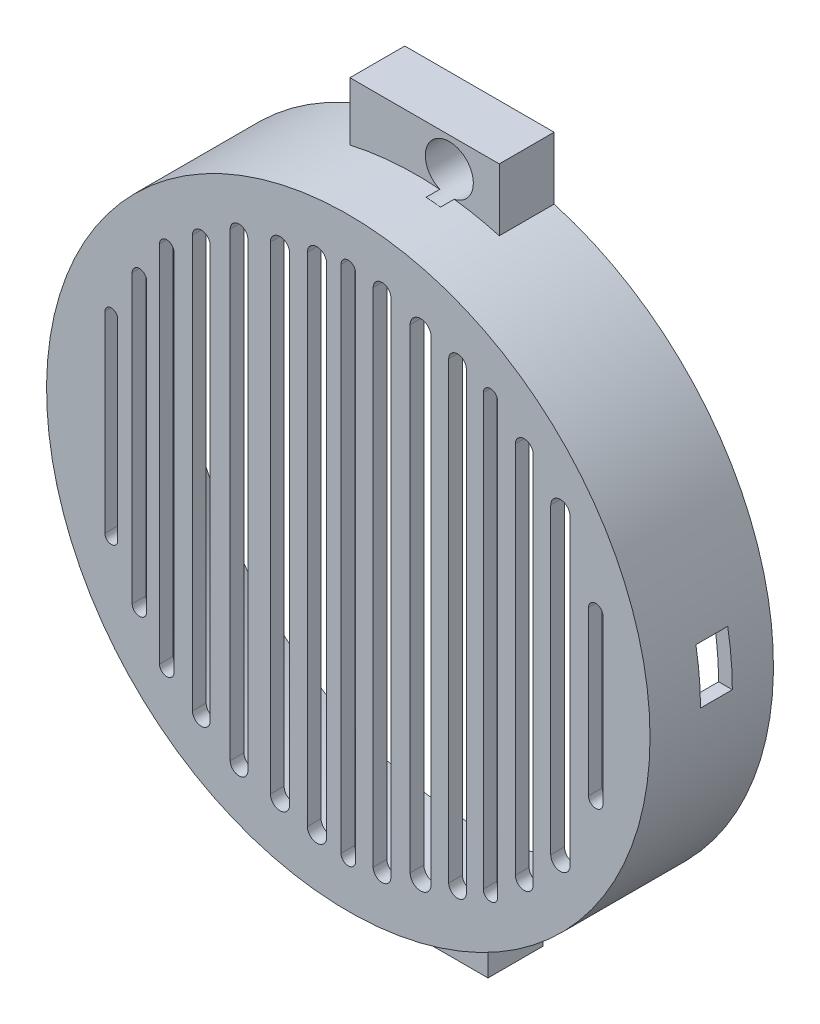
from build123d import *

# Parameters (mm, degrees)
SKETCH1_R           = 22
BOSS_EXTRUDE1_DEPTH = 9
SHELL2_T            = -1
CUT_EXTRUDE1_DEPTH  = 5
CUT_EXTRUDE2_DEPTH  = 5
SKETCH24_W          = 2.319445398
SKETCH24_H          = 3.83352781
CUT_EXTRUDE3_DEPTH  = 5
SKETCH25_W          = 10.887577437
SKETCH25_H          = 4.540244535
BOSS_EXTRUDE2_DEPTH = 4
SKETCH26_R          = 1.75
CUT_EXTRUDE4_DEPTH  = 5
SKETCH27_W          = 9.75823175
SKETCH27_H          = 4.730401218
BOSS_EXTRUDE3_DEPTH = 4
SKETCH28_R          = 1.75
CUT_EXTRUDE5_DEPTH  = 6


with BuildPart() as part:
    # Sketch1 → Boss-Extrude1 (new body)
    with BuildSketch(Plane.XY):
        Circle(SKETCH1_R)
    extrude(amount=BOSS_EXTRUDE1_DEPTH)

    # Shell2
    shell2_openings = [part.faces().sort_by_distance(p)[0] for p in [
        (0, 0, 0),
    ]]
    offset(amount=SHELL2_T, openings=shell2_openings, kind=Kind.INTERSECTION)

    # Sketch23 → Cut-Extrude1 (cut)
    with BuildSketch(Plane(origin=(0, 0, 8), x_dir=(-1, 0, 0), z_dir=(0, 0, -1))):
        with BuildLine():
            Line((-3.104308234, -18.303704212), (-3.104308234, 18.303704212))
            ThreePointArc((-3.104308234, 18.303704212), (-2.460017846, 18.9479946), (-1.815727458, 18.303704212))
            Line((-1.815727458, 18.303704212), (-1.815727458, -18.303704212))
            ThreePointArc((-1.815727458, -18.303704212), (-2.460017846, -18.9479946), (-3.104308234, -18.303704212))
        make_face()
        with BuildLine():
            Line((-6.032900908, -17.307982703), (-6.032900908, 17.307982703))
            ThreePointArc((-6.032900908, 17.307982703), (-5.271466813, 18.069416798), (-4.510032718, 17.307982703))
            Line((-4.510032718, 17.307982703), (-4.510032718, -17.307982703))
            ThreePointArc((-4.510032718, -17.307982703), (-5.271466813, -18.069416798), (-6.032900908, -17.307982703))
        make_face()
        with BuildLine():
            Line((-8.610062461, -16.546548608), (-8.610062461, 16.546548608))
            ThreePointArc((-8.610062461, 16.546548608), (-7.965772073, 17.190838996), (-7.321481685, 16.546548608))
            Line((-7.321481685, 16.546548608), (-7.321481685, -16.546548608))
            ThreePointArc((-7.321481685, -16.546548608), (-7.965772073, -17.190838996), (-8.610062461, -16.546548608))
        make_face()
        with BuildLine():
            Line((-10.894364747, -15.667970806), (-10.894364747, 15.667970806))
            ThreePointArc((-10.894364747, 15.667970806), (-10.367218066, 16.195117487), (-9.840071384, 15.667970806))
            Line((-9.840071384, 15.667970806), (-9.840071384, -15.667970806))
            ThreePointArc((-9.840071384, -15.667970806), (-10.367218066, -16.195117487), (-10.894364747, -15.667970806))
        make_face()
        with BuildLine():
            Line((-13.4715263, -13.617955934), (-13.4715263, 13.617955934))
            ThreePointArc((-13.4715263, 13.617955934), (-12.827235912, 14.262246322), (-12.182945524, 13.617955934))
            Line((-12.182945524, 13.617955934), (-12.182945524, -13.617955934))
            ThreePointArc((-12.182945524, -13.617955934), (-12.827235912, -14.262246322), (-13.4715263, -13.617955934))
        make_face()
        with BuildLine():
            Line((-16.16583156, -11.040794381), (-16.16583156, 11.040794381))
            ThreePointArc((-16.16583156, 11.040794381), (-15.462969318, 11.743656623), (-14.760107077, 11.040794381))
            Line((-14.760107077, 11.040794381), (-14.760107077, -11.040794381))
            ThreePointArc((-14.760107077, -11.040794381), (-15.462969318, -11.743656623), (-16.16583156, -11.040794381))
        make_face()
        with BuildLine():
            Line((-18.567277553, -5.945043128), (-18.567277553, 5.945043128))
            ThreePointArc((-18.567277553, 5.945043128), (-18.040130871, 6.472189809), (-17.51298419, 5.945043128))
            Line((-17.51298419, 5.945043128), (-17.51298419, -5.945043128))
            ThreePointArc((-17.51298419, -5.945043128), (-18.040130871, -6.472189809), (-18.567277553, -5.945043128))
        make_face()
    extrude(amount=-CUT_EXTRUDE1_DEPTH, mode=Mode.SUBTRACT)

    # Sketch22 → Cut-Extrude2 (cut)
    with BuildSketch(Plane(origin=(0, 0, 8), x_dir=(-1, 0, 0), z_dir=(0, 0, -1))):
        with BuildLine():
            Line((-0.527146681, -18.59656348), (-0.527146681, 18.59656348))
            ThreePointArc((-0.527146681, 18.59656348), (0, 19.123710161), (0.527146681, 18.59656348))
            Line((0.527146681, 18.59656348), (0.527146681, -18.59656348))
            ThreePointArc((0.527146681, -18.59656348), (0, -19.123710161), (-0.527146681, -18.59656348))
        make_face()
        with BuildLine():
            Line((1.581440044, -18.127988652), (1.581440044, 18.127988652))
            ThreePointArc((1.581440044, 18.127988652), (2.284302286, 18.830850893), (2.987164527, 18.127988652))
            Line((2.987164527, 18.127988652), (2.987164527, -18.127988652))
            ThreePointArc((2.987164527, -18.127988652), (2.284302286, -18.830850893), (1.581440044, -18.127988652))
        make_face()
        with BuildLine():
            Line((4.275745304, -17.42512641), (4.275745304, 17.42512641))
            ThreePointArc((4.275745304, 17.42512641), (4.978607546, 18.127988652), (5.681469787, 17.42512641))
            Line((5.681469787, 17.42512641), (5.681469787, -17.42512641))
            ThreePointArc((5.681469787, -17.42512641), (4.978607546, -18.127988652), (4.275745304, -17.42512641))
        make_face()
        with BuildLine():
            Line((7.321481685, -16.780836022), (7.321481685, 16.780836022))
            ThreePointArc((7.321481685, 16.780836022), (7.965772073, 17.42512641), (8.610062461, 16.780836022))
            Line((8.610062461, 16.780836022), (8.610062461, -16.780836022))
            ThreePointArc((8.610062461, -16.780836022), (7.965772073, -17.42512641), (7.321481685, -16.780836022))
        make_face()
        with BuildLine():
            Line((10.074358798, -15.023680417), (10.074358798, 15.023680417))
            ThreePointArc((10.074358798, 15.023680417), (10.718649187, 15.667970806), (11.362939575, 15.023680417))
            Line((11.362939575, 15.023680417), (11.362939575, -15.023680417))
            ThreePointArc((11.362939575, -15.023680417), (10.718649187, -15.667970806), (10.074358798, -15.023680417))
        make_face()
        with BuildLine():
            Line((12.710092205, -13.266524813), (12.710092205, 13.266524813))
            ThreePointArc((12.710092205, 13.266524813), (13.237238886, 13.793671494), (13.764385568, 13.266524813))
            Line((13.764385568, 13.266524813), (13.764385568, -13.266524813))
            ThreePointArc((13.764385568, -13.266524813), (13.237238886, -13.793671494), (12.710092205, -13.266524813))
        make_face()
        with BuildLine():
            Line((14.701535223, -10.455075846), (14.701535223, 10.455075846))
            ThreePointArc((14.701535223, 10.455075846), (15.228681905, 10.982222527), (15.755828586, 10.455075846))
            Line((15.755828586, 10.455075846), (15.755828586, -10.455075846))
            ThreePointArc((15.755828586, -10.455075846), (15.228681905, -10.982222527), (14.701535223, -10.455075846))
        make_face()
        with BuildLine():
            Line((16.810121948, -6.999336491), (16.810121948, 6.999336491))
            ThreePointArc((16.810121948, 6.999336491), (17.278696776, 7.467911319), (17.747271604, 6.999336491))
            Line((17.747271604, 6.999336491), (17.747271604, -6.999336491))
            ThreePointArc((17.747271604, -6.999336491), (17.278696776, -7.467911319), (16.810121948, -6.999336491))
        make_face()
    extrude(amount=-CUT_EXTRUDE2_DEPTH, mode=Mode.SUBTRACT)

    # Sketch24 → Cut-Extrude3 (cut)
    with BuildSketch(Plane(origin=(22, 0, 0), x_dir=(0, 0, -1), z_dir=(1, 0, 0))):
        with Locations((-4.159722699, 1.916763905)):
            Rectangle(SKETCH24_W, SKETCH24_H)
    extrude(amount=-CUT_EXTRUDE3_DEPTH, mode=Mode.SUBTRACT)

    # Sketch25 → Boss-Extrude2 (add)
    with BuildSketch(Plane(origin=(0, 0, 0), x_dir=(-1, 0, 0), z_dir=(0, 0, -1))):
        with Locations((-0.56321323, 23.434146639)):
            Rectangle(SKETCH25_W, SKETCH25_H)
    extrude(amount=-BOSS_EXTRUDE2_DEPTH)

    # Sketch26 → Cut-Extrude4 (cut)
    with BuildSketch(Plane(origin=(0, 0, 0), x_dir=(-1, 0, 0), z_dir=(0, 0, -1))):
        with Locations((-2.366226378, 23.54446207)):
            Circle(SKETCH26_R)
    extrude(amount=-CUT_EXTRUDE4_DEPTH, mode=Mode.SUBTRACT)

    # Sketch27 → Boss-Extrude3 (add)
    with BuildSketch(Plane(origin=(0, 0, 0), x_dir=(-1, 0, 0), z_dir=(0, 0, -1))):
        with Locations((-0.307450986, -23.745086582)):
            Rectangle(SKETCH27_W, SKETCH27_H)
    extrude(amount=-BOSS_EXTRUDE3_DEPTH)

    # Sketch28 → Cut-Extrude5 (cut)
    with BuildSketch(Plane(origin=(0, 0, 0), x_dir=(-1, 0, 0), z_dir=(0, 0, -1))):
        with Locations((0, -23.598199513)):
            Circle(SKETCH28_R)
    extrude(amount=-CUT_EXTRUDE5_DEPTH, mode=Mode.SUBTRACT)


solid = part.part
